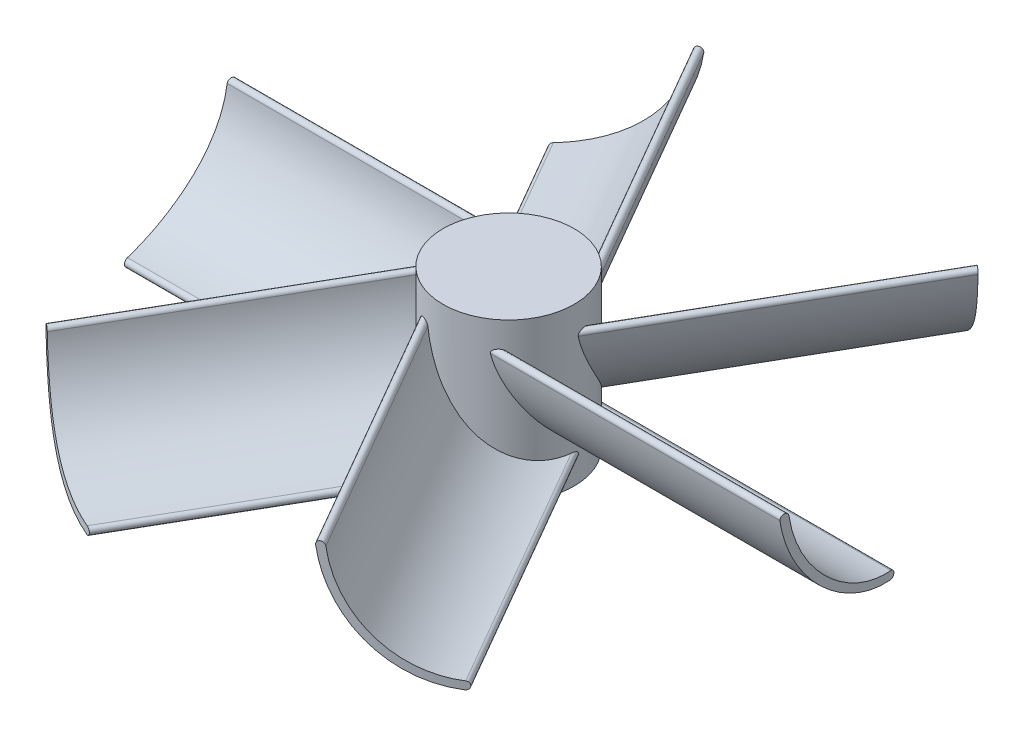
from build123d import *

# Parameters (mm, degrees)
IZIM1_R                     = 25
Y_KSEKLIK_EKSTR_ZYON1_DEPTH = 60
Y_KSEKLIK_EKSTR_ZYON2_DEPTH = 120
DAIRESEL_KAPLAMA1_COUNT     = 6
IZIM4_OUTSIDE_W             = 334.808
IZIM4_OUTSIDE_H             = 322.453
IZIM4_OUTSIDE_R             = 126.169534114
KES_EKSTR_ZYON1_DEPTH       = 120


with BuildPart() as part:
    # Çizim1 → Yükseklik-Ekstrüzyon1 (new body)
    with BuildSketch(Plane(origin=(0, 0, 0), x_dir=(1, 0, 0), z_dir=(0, 1, 0))):
        with Locations(Location((0, -1.215587275, 0), (0, 0, 270))):
            Circle(IZIM1_R)
    extrude(amount=Y_KSEKLIK_EKSTR_ZYON1_DEPTH)

    # Çizim2 → Yükseklik-Ekstrüzyon2 (add)
    with BuildSketch(Plane(origin=(130, 0, 0), x_dir=(0, 0, -1), z_dir=(1, 0, 0))):
        with BuildLine():
            ThreePointArc((-19.041262861, 48.969586712), (-6.232766913, 23.283881107), (19.892108756, 11.396748898))
            ThreePointArc((19.892108756, 11.396748898), (21.257056095, 9.77288968), (19.633196877, 8.407942341))
            ThreePointArc((19.633196877, 8.407942341), (-8.316033768, 21.125177976), (-22.018973909, 48.604570388))
            ThreePointArc((-22.018973909, 48.604570388), (-20.712626547, 50.275934074), (-19.041262861, 48.969586712))
        make_face()
    y_kseklik_ekstr_zyon2 = extrude(amount=-Y_KSEKLIK_EKSTR_ZYON2_DEPTH)

    # Dairesel Kaplama1: Yükseklik-Ekstrüzyon2 ×6 about axis
    dairesel_kaplama1_axis = Axis((0, 0, 1.215587275), (0, 1, 0))
    for i in range(1, DAIRESEL_KAPLAMA1_COUNT):
        add(y_kseklik_ekstr_zyon2.rotate(dairesel_kaplama1_axis, i * 360 / DAIRESEL_KAPLAMA1_COUNT))

    # Çizim4 outside → Kes-Ekstrüzyon1 (cut)
    with BuildSketch(Plane(origin=(0, 60, 0), x_dir=(1, 0, 0), z_dir=(0, 1, 0))):
        with Locations((0, -1.2155)):
            Rectangle(IZIM4_OUTSIDE_W, IZIM4_OUTSIDE_H)
        Circle(IZIM4_OUTSIDE_R, mode=Mode.SUBTRACT)
    extrude(amount=-KES_EKSTR_ZYON1_DEPTH, mode=Mode.SUBTRACT)


solid = part.part
